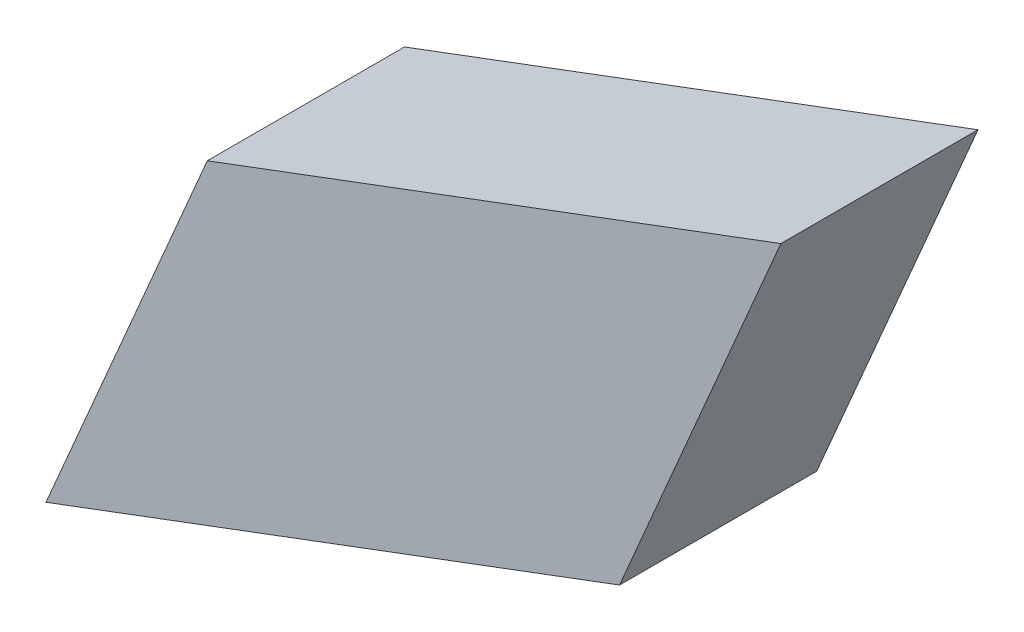
from build123d import *

# Parameters (mm, degrees)
BOSS_EXTRUDE1_DEPTH = 11


with BuildPart() as part:
    # Sketch1 → Boss-Extrude1 (new body)
    with BuildSketch(Plane.XY):
        Polygon((3, 4), (35, 16), (44, 37), (12, 25), align=None)
    extrude(amount=BOSS_EXTRUDE1_DEPTH)


solid = part.part
